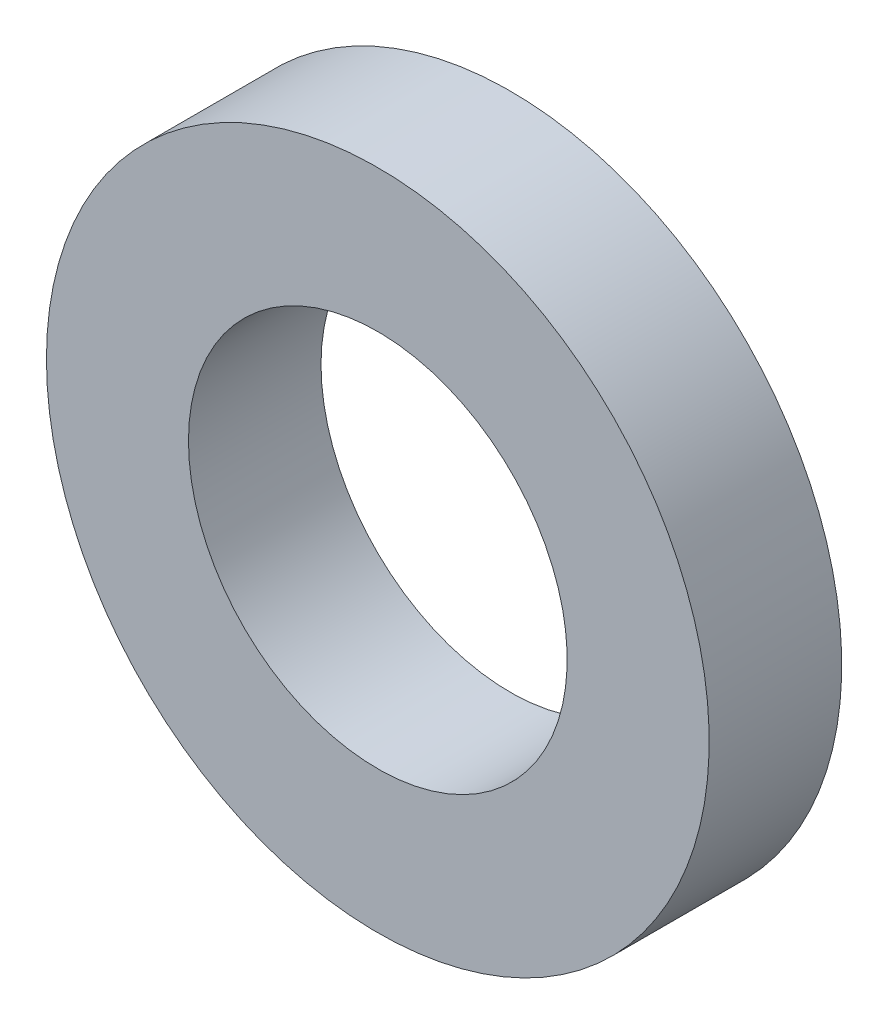
from build123d import *

# Parameters (mm, degrees)
SKETCH_1_R      = 35
SKETCH_1_R_2    = 20
EXTRUDE_1_DEPTH = 14


with BuildPart() as part:
    # 草图1 → 凸台-拉伸1 (new body)
    with BuildSketch(Plane.XY):
        with Locations(Location((0, 0, 0), (0, 0, 180))):
            Circle(SKETCH_1_R)
        with Locations(Location((0, 0, 0), (0, 0, 180))):
            Circle(SKETCH_1_R_2, mode=Mode.SUBTRACT)
    extrude(amount=EXTRUDE_1_DEPTH)


solid = part.part
